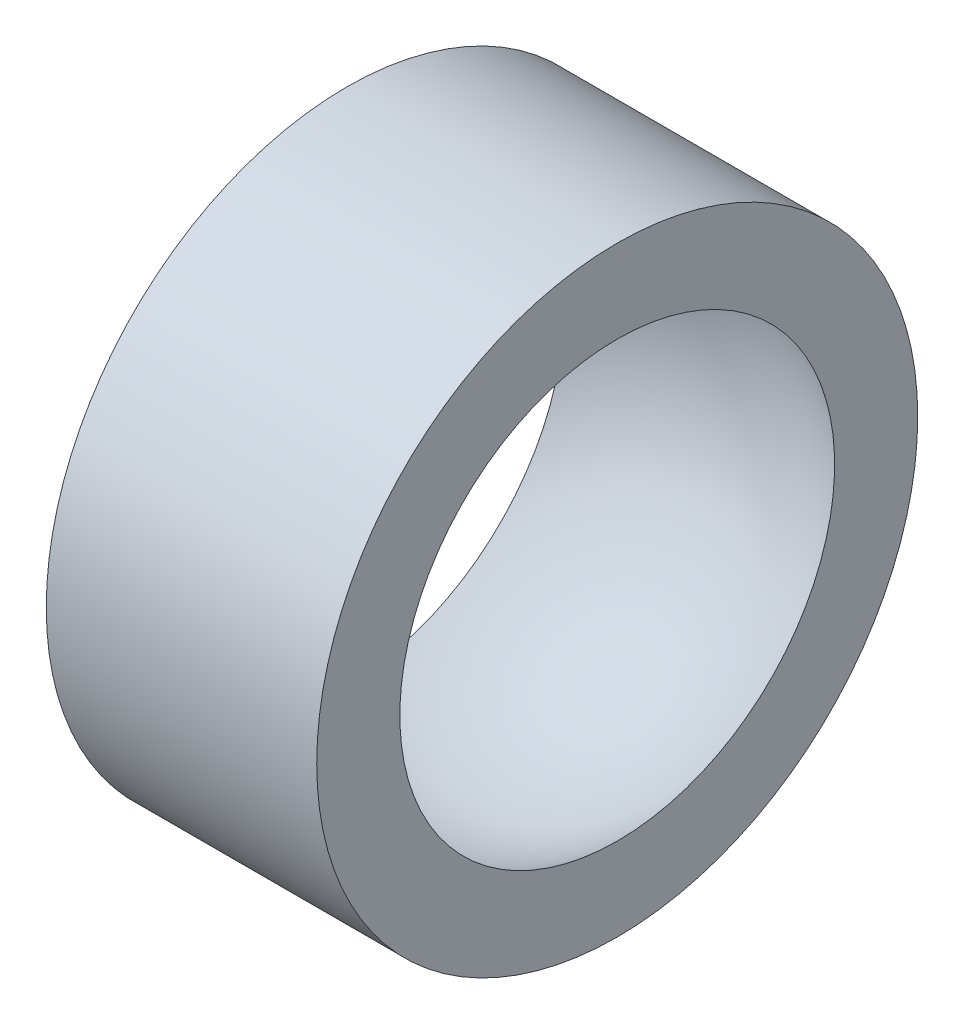
from build123d import *


with BuildPart() as part:
    # Sketch1 → Revolve1 (revolve)
    with BuildSketch(Plane.XY):
        with BuildLine():
            Line((-3.375, 7.5), (-3.375, 5.425999908))
            ThreePointArc((-3.375, 5.425999908), (0, 6.39), (3.375, 5.425999908))
            Line((3.375, 5.425999908), (3.375, 7.5))
            Line((3.375, 7.5), (-3.375, 7.5))
        make_face()
    revolve(axis=Axis((0, 0, 0), (1, 0, 0)))


solid = part.part
